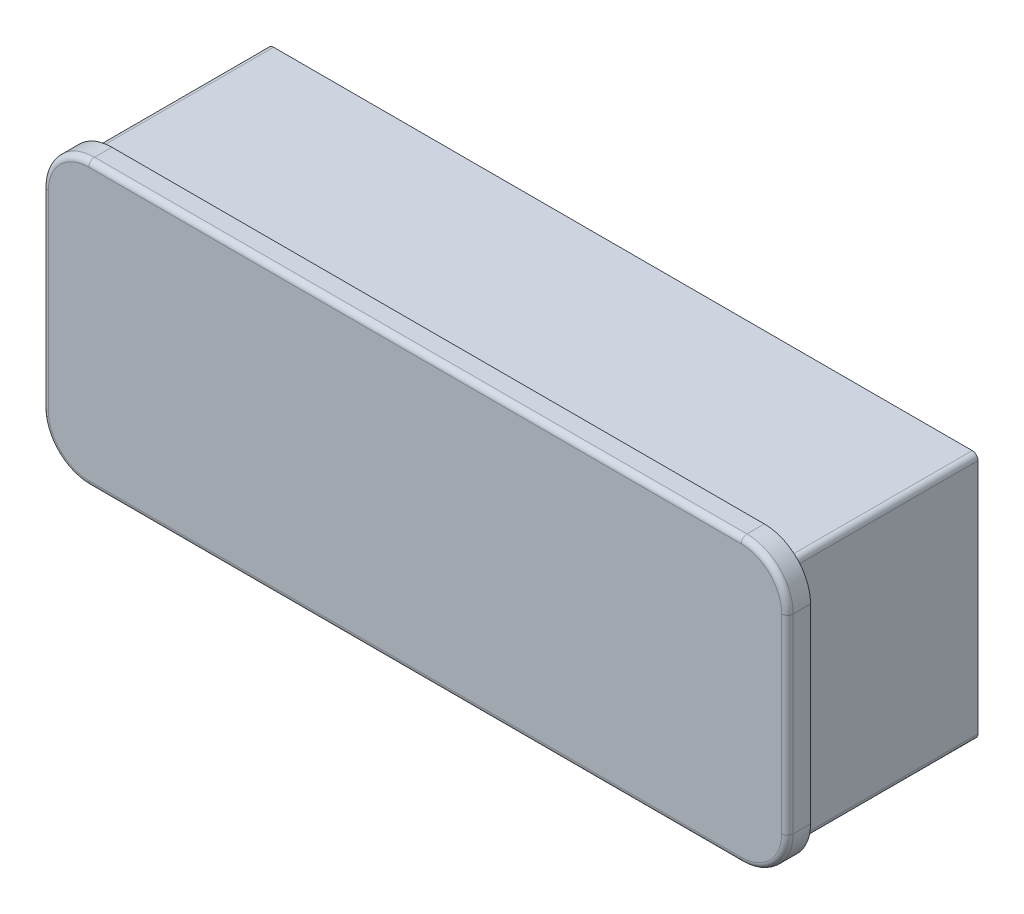
from build123d import *

# Parameters (mm, degrees)
SKETCH1_W           = 30.746
SKETCH1_H           = 10.746
SKETCH1_W_2         = 29.246
SKETCH1_H_2         = 9.246
BOSS_EXTRUDE1_DEPTH = 8
SKETCH2_W           = 32.246
SKETCH2_H           = 12.246
BOSS_EXTRUDE2_DEPTH = 1
FILLET2_R           = 0.25
FILLET3_R           = 2
FILLET4_R           = 1
FILLET5_R           = 0.25


with BuildPart() as part:
    # Sketch1 → Boss-Extrude1 (new body)
    with BuildSketch(Plane.XY):
        with Locations((0, 38)):
            Rectangle(SKETCH1_W, SKETCH1_H)
        with Locations((0, 38)):
            Rectangle(SKETCH1_W_2, SKETCH1_H_2, mode=Mode.SUBTRACT)
    extrude(amount=BOSS_EXTRUDE1_DEPTH)

    # Sketch2 → Boss-Extrude2 (add)
    with BuildSketch(Plane.XY.offset(8)):
        with Locations((0, 38)):
            Rectangle(SKETCH2_W, SKETCH2_H)
    extrude(amount=BOSS_EXTRUDE2_DEPTH)

    # Fillet2
    fillet2_edges = [part.edges().sort_by_distance(p)[0] for p in [
        (-15.373, 43.373, 4),
        (15.373, 43.373, 4),
        (15.373, 32.627, 4),
        (-15.373, 32.627, 4),
    ]]
    fillet(fillet2_edges, radius=FILLET2_R)

    # Fillet3
    fillet3_edges = [part.edges().sort_by_distance(p)[0] for p in [
        (-16.123, 31.877, 8.5),
        (16.123, 31.877, 8.5),
        (16.123, 44.123, 8.5),
        (-16.123, 44.123, 8.5),
    ]]
    fillet(fillet3_edges, radius=FILLET3_R)

    # Fillet4
    fillet4_edges = [part.edges().sort_by_distance(p)[0] for p in [
        (14.623, 33.377, 4),
        (14.623, 42.623, 4),
        (-14.623, 42.623, 4),
        (-14.623, 33.377, 4),
    ]]
    fillet(fillet4_edges, radius=FILLET4_R)

    # Fillet5
    fillet5_edges = [part.edges().sort_by_distance(p)[0] for p in [
        (0, 44.123, 9),
        (16.123, 38, 9),
        (0, 31.877, 9),
        (-16.123, 38, 9),
        (-15.537213562, 43.537213562, 9),
        (-15.537213562, 32.462786438, 9),
        (15.537213562, 32.462786438, 9),
        (15.537213562, 43.537213562, 9),
    ]]
    fillet(fillet5_edges, radius=FILLET5_R)


solid = part.part
